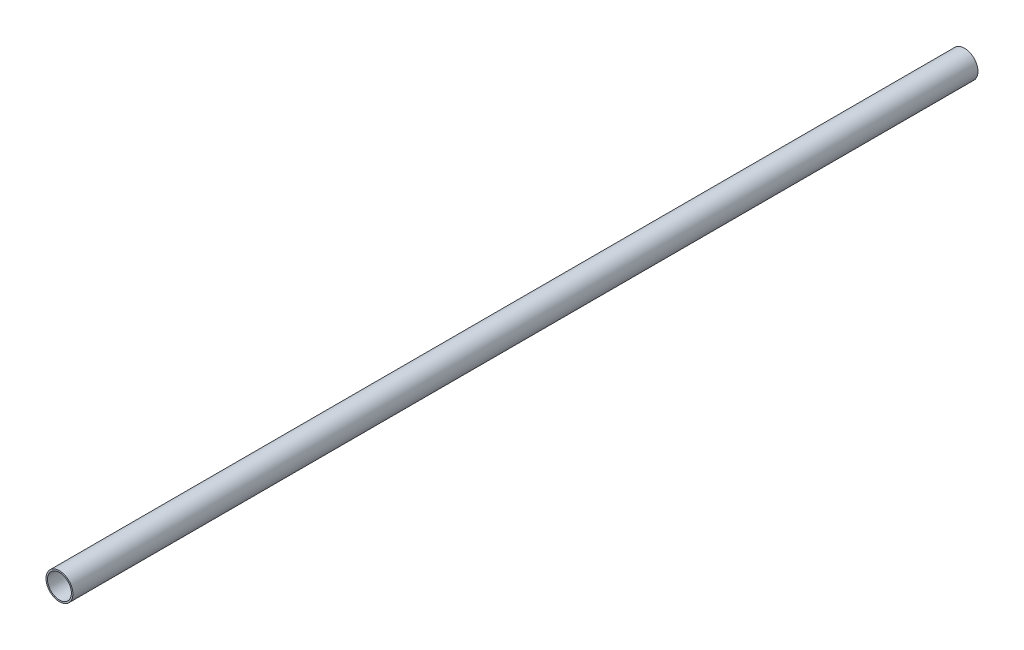
from build123d import *

# Parameters (mm, degrees)
SKETCH1_R           = 7.9375
SKETCH1_R_2         = 7.0485
BOSS_EXTRUDE1_DEPTH = 266.7


with BuildPart() as part:
    # Sketch1 → Boss-Extrude1 (new, symmetric)
    with BuildSketch(Plane.XY):
        Circle(SKETCH1_R)
        Circle(SKETCH1_R_2, mode=Mode.SUBTRACT)
    extrude(amount=BOSS_EXTRUDE1_DEPTH, both=True)


solid = part.part
